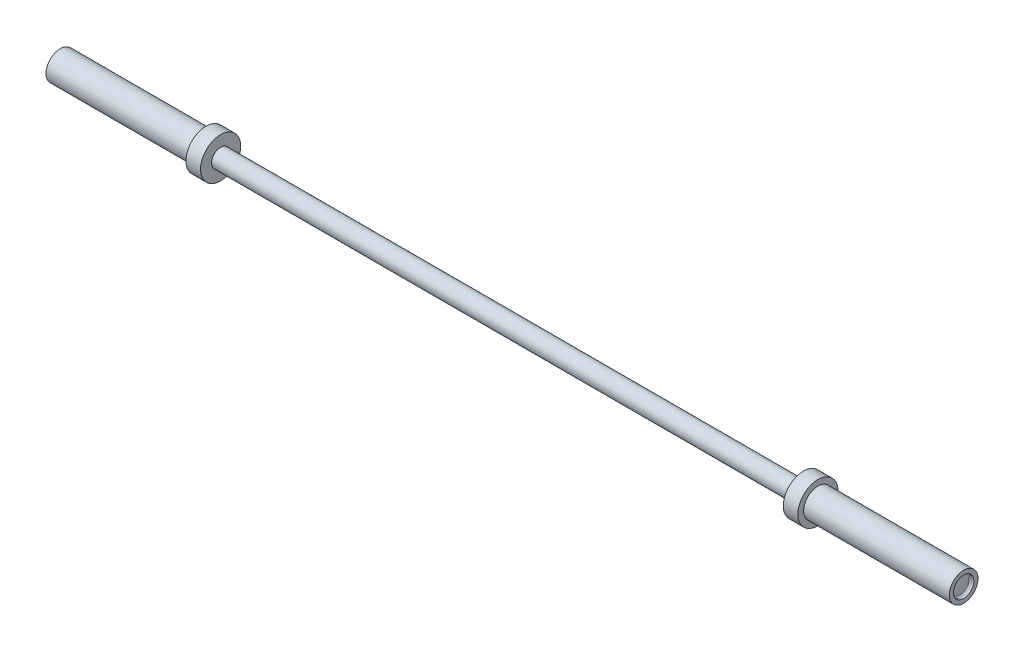
from build123d import *

# Parameters (mm, degrees)
SKETCH1_R           = 15.875
BOSS_EXTRUDE1_DEPTH = 1016
SKETCH2_R           = 34.999999977
BOSS_EXTRUDE2_DEPTH = 25.4
BOSS_EXTRUDE3_START = 25.4
SKETCH3_R           = 34.999999977
BOSS_EXTRUDE3_DEPTH = 25.4
SKETCH4_R           = 25
BOSS_EXTRUDE4_DEPTH = 254
BOSS_EXTRUDE5_START = 254
SKETCH5_R           = 25
BOSS_EXTRUDE5_DEPTH = 254
SKETCH6_R           = 17.78
CUT_EXTRUDE1_DEPTH  = 6.35
CUT_EXTRUDE2_START  = -6.35
SKETCH7_R           = 17.78
CUT_EXTRUDE2_DEPTH  = 6.35
FILLET1_R           = 2.54


with BuildPart() as part:
    # Sketch1 → Boss-Extrude1 (new body)
    with BuildSketch(Plane(origin=(0, 0, 0), x_dir=(0, 0, -1), z_dir=(1, 0, 0))):
        Circle(SKETCH1_R)
    extrude(amount=BOSS_EXTRUDE1_DEPTH)

    # Sketch2 → Boss-Extrude2 (add)
    with BuildSketch(Plane(origin=(1016, 0, 0), x_dir=(0, 0, -1), z_dir=(1, 0, 0))):
        Circle(SKETCH2_R)
    extrude(amount=BOSS_EXTRUDE2_DEPTH)

    # Sketch3 → Boss-Extrude3 (add)
    with BuildSketch(Plane.ZY.offset(BOSS_EXTRUDE3_START)):
        with Locations(Location((0, 0, 0), (0, 0, 180))):
            Circle(SKETCH3_R)
    extrude(amount=-BOSS_EXTRUDE3_DEPTH)

    # Sketch4 → Boss-Extrude4 (add)
    with BuildSketch(Plane(origin=(1041.4, 0, 0), x_dir=(0, 0, -1), z_dir=(1, 0, 0))):
        Circle(SKETCH4_R)
    extrude(amount=BOSS_EXTRUDE4_DEPTH)

    # Sketch5 → Boss-Extrude5 (add)
    with BuildSketch(Plane.ZY.offset(25.4).offset(BOSS_EXTRUDE5_START)):
        with Locations(Location((0, 0, 0), (0, 0, 180))):
            Circle(SKETCH5_R)
    extrude(amount=-BOSS_EXTRUDE5_DEPTH)

    # Sketch6 → Cut-Extrude1 (cut)
    with BuildSketch(Plane.ZY.offset(279.4)):
        Circle(SKETCH6_R)
    extrude(amount=-CUT_EXTRUDE1_DEPTH, mode=Mode.SUBTRACT)

    # Sketch7 → Cut-Extrude2 (cut)
    with BuildSketch(Plane(origin=(1295.4, 0, 0), x_dir=(0, 0, -1), z_dir=(1, 0, 0)).offset(CUT_EXTRUDE2_START)):
        with Locations(Location((0, 0, 0), (0, 0, 180))):
            Circle(SKETCH7_R)
    extrude(amount=CUT_EXTRUDE2_DEPTH, mode=Mode.SUBTRACT)

    # Fillet1
    fillet1_edges = [part.edges().sort_by_distance(p)[0] for p in [
        (-273.05, 0, -17.78),
        (1289.05, 0, -17.78),
    ]]
    fillet(fillet1_edges, radius=FILLET1_R)


solid = part.part
